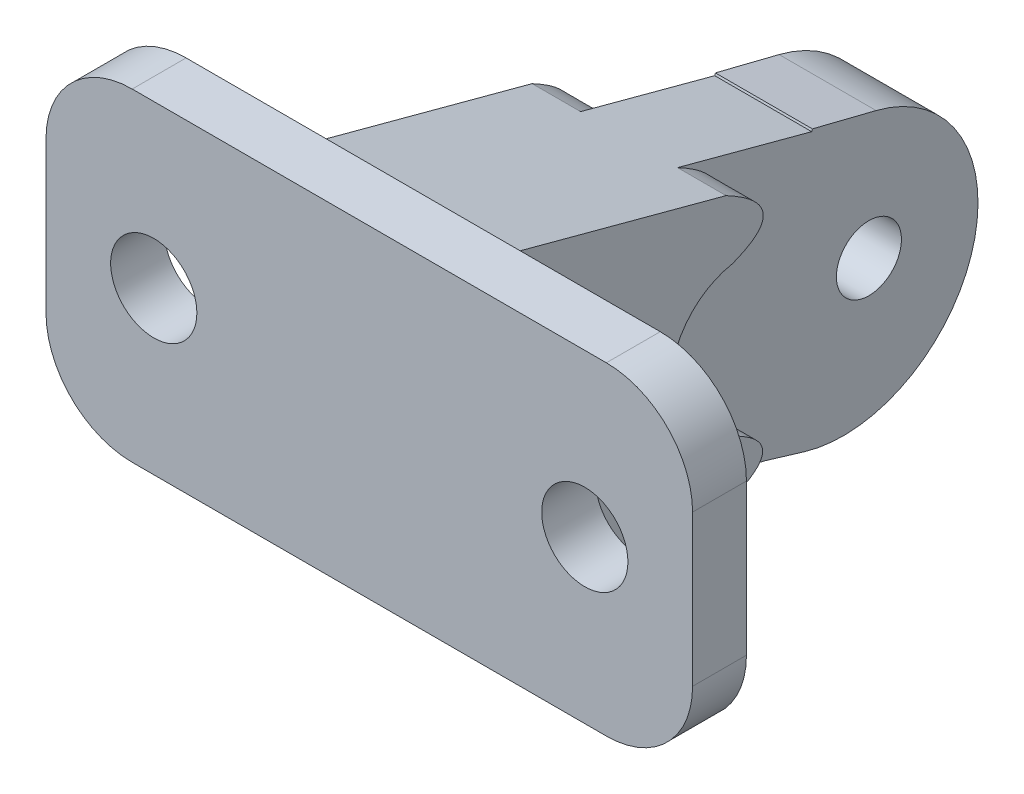
from build123d import *

# Parameters (mm, degrees)
SKETCH6_W            = 60
SKETCH6_H            = 30
SKETCH6_R            = 4
BOSS_EXTRUDE1_DEPTH  = 5
FILLET3_R            = 8
SKETCH8_W            = 18
SKETCH8_H            = 30
BOSS_EXTRUDE2_DEPTH  = 45
CUT_EXTRUDE1_DEPTH   = 20
CUT_EXTRUDE3_DEPTH   = 18
CUT_EXTRUDE4_DEPTH   = 18
BOSS_EXTRUDE4_DEPTH  = 18
SKETCH22_OUTSIDE_W   = 79.302
SKETCH22_OUTSIDE_H   = 78.983
SKETCH22_OUTSIDE_W_2 = 9
SKETCH22_OUTSIDE_H_2 = 23.546077941
CUT_EXTRUDE5_DEPTH   = 58
SKETCH26_W           = 9
SKETCH26_H           = 16.7
BOSS_EXTRUDE6_DEPTH  = 24.59
SKETCH27_R           = 3.017273599
CUT_EXTRUDE6_DEPTH   = 24.59


with BuildPart() as part:
    # Sketch6 → Boss-Extrude1 (new body)
    with BuildSketch(Plane.XY):
        Rectangle(SKETCH6_W, SKETCH6_H)
        with Locations((-20, 0)):
            Circle(SKETCH6_R, mode=Mode.SUBTRACT)
        with Locations((20, 0)):
            Circle(SKETCH6_R, mode=Mode.SUBTRACT)
    extrude(amount=BOSS_EXTRUDE1_DEPTH)

    # Fillet3
    fillet3_edges = [part.edges().sort_by_distance(p)[0] for p in [
        (30, -15, 2.5),
        (-30, -15, 2.5),
        (-30, 15, 2.5),
        (30, 15, 2.5),
    ]]
    fillet(fillet3_edges, radius=FILLET3_R)

    # Sketch8 → Boss-Extrude2 (add)
    with BuildSketch(Plane(origin=(0, 0, 0), x_dir=(-1, 0, 0), z_dir=(0, 0, -1))):
        Rectangle(SKETCH8_W, SKETCH8_H)
    extrude(amount=BOSS_EXTRUDE2_DEPTH)

    # Sketch10 → Cut-Extrude1 (cut)
    with BuildSketch(Plane.ZY.offset(9)):
        Polygon((0, 15), (-45, 2.942286341), (-45, 15), align=None)
    extrude(amount=-CUT_EXTRUDE1_DEPTH, mode=Mode.SUBTRACT)

    # Sketch17 → Cut-Extrude3 (cut)
    with BuildSketch(Plane.ZY.offset(9)):
        with BuildLine():
            Line((-19.10592487, 9.880582861), (-33.795007399, 5.944655059))
            Line((-33.795007399, 5.944655059), (-33.112800495, -15))
            Line((-33.112800495, -15), (-19.10592487, -15))
            add(Edge.make_bspline(
                [(-19.396101376, -9.592611332), (-25.746279691, -12.541160343), (-19.10592487, -15)],
                knots=[0, 0, 0, 1, 1, 1], degree=2))
            ThreePointArc((-19.396101376, -9.592611332), (-13.970550224, -2.605507152), (-19.721316162, 4.116465866))
            add(Edge.make_bspline(
                [(-19.10592487, 9.880582861), (-25.688303674, 6.38873808), (-19.721316162, 4.116465866)],
                knots=[0, 0, 0, 1, 1, 1], degree=2))
        make_face()
    extrude(amount=-CUT_EXTRUDE3_DEPTH, mode=Mode.SUBTRACT)


with BuildPart() as cut_extrude3_piece_1:
    # of the separate pieces the step leaves, piece 1, a body of its own (cut_extrude3_pieces)
    add(part.part.solids().sort_by_distance((-22, 15, 0))[0])



with BuildPart() as cut_extrude3_piece_2:
    # of the separate pieces the step leaves, piece 2, a body of its own (cut_extrude3_pieces)
    add(part.part.solids().sort_by_distance((-9, 5.944655059, -33.795007399))[0])

    # Sketch18 → Cut-Extrude4 (cut)
    with BuildSketch(Plane.ZY.offset(9)):
        Polygon((-45, 2.942286341), (-33.795007399, 5.944655059), (-33.112800495, -15), (-45, -15), align=None)
    extrude(amount=-CUT_EXTRUDE4_DEPTH, mode=Mode.SUBTRACT)


with BuildPart() as body_2:
    # Sketch20 → Boss-Extrude4 (new body)
    with BuildSketch(Plane.ZY.offset(9)):
        with BuildLine():
            Line((-37.531427351, 5.25433557), (-25.054150065, 8.387111476))
            Line((-25.054150065, 8.387111476), (-24.501921516, -16.92005289))
            Line((-24.501921516, -16.92005289), (-30.888633919, -18.84010578))
            ThreePointArc((-30.888633919, -18.84010578), (-46.53784137, -10.191639988), (-37.531427351, 5.25433557))
        make_face()
    extrude(amount=-BOSS_EXTRUDE4_DEPTH)

    # Sketch22 outside → Cut-Extrude5 (cut)
    with BuildSketch(Plane(origin=(0, -8.762066283, 2.634161307), x_dir=(1, 0, 0), z_dir=(0, -0.9576594298343689, 0.2879034846077966))):
        with Locations((0, -20.7335)):
            Rectangle(SKETCH22_OUTSIDE_W, SKETCH22_OUTSIDE_H)
        with Locations((0, -40.108877346)):
            Rectangle(SKETCH22_OUTSIDE_W_2, SKETCH22_OUTSIDE_H_2, mode=Mode.SUBTRACT)
    extrude(amount=-CUT_EXTRUDE5_DEPTH, mode=Mode.SUBTRACT)


with BuildPart() as cut_extrude3_piece_1_1:
    add(cut_extrude3_piece_1.part)

    add(body_2.part)  # Boss-Extrude6 merges body 2
    # Sketch26 → Boss-Extrude6 (add)
    with BuildSketch(Plane(origin=(0, 13.995190528, -3.75), x_dir=(1, 0, 0), z_dir=(0, 0.9659258262890699, -0.2588190451025147))):
        with Locations((0, 22.410404796)):
            Rectangle(SKETCH26_W, SKETCH26_H)
    extrude(amount=-BOSS_EXTRUDE6_DEPTH)

    # Sketch27 → Cut-Extrude6 (cut)
    with BuildSketch(Plane.ZY.offset(4.5)):
        with Locations(Location((-36.863547302, -6.273312821, 0), (0, 0, 270))):
            Circle(SKETCH27_R)
    extrude(amount=-CUT_EXTRUDE6_DEPTH, mode=Mode.SUBTRACT)


solid = cut_extrude3_piece_1_1.part
